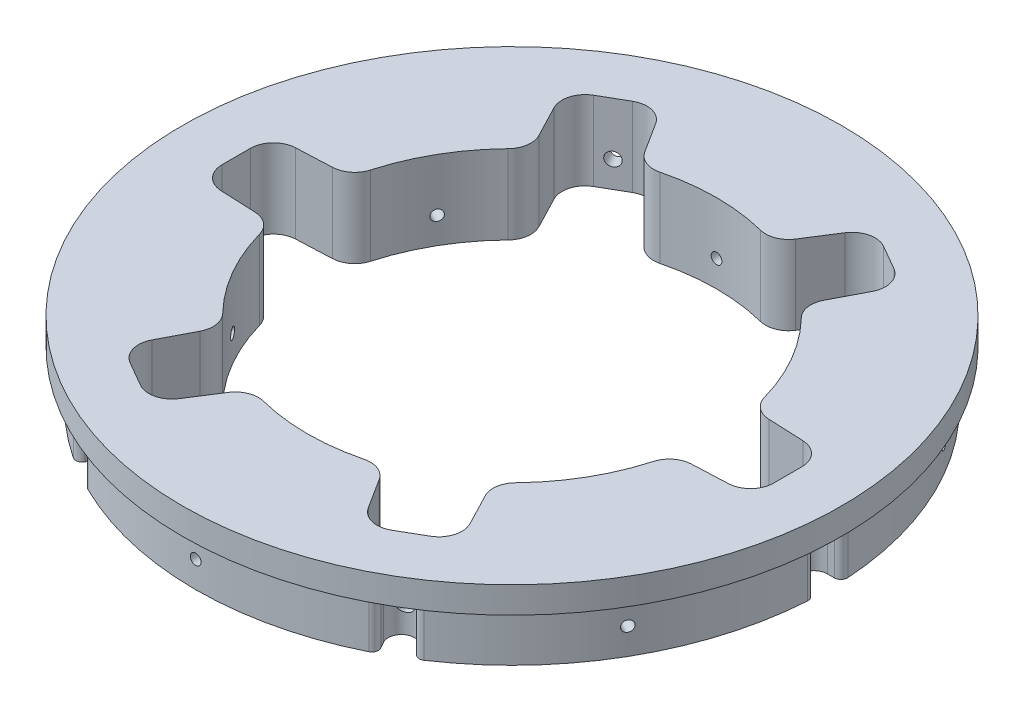
from build123d import *

# Parameters (mm, degrees)
SKETCH1_R                        = 76.2
SKETCH1_R_2                      = 49.276
BOSS_EXTRUDE1_DEPTH              = 19.05
CUT_EXTRUDE1_START               = -12.7
CUT_EXTRUDE1_DEPTH               = 12.7
CUT_EXTRUDE2_DEPTH               = 110.433918417
F_30_0_1285_DIAMETER_HOLE1_D     = 3.2639
F_30_0_1285_DIAMETER_HOLE1_DEPTH = 9.779
FILLET1_R                        = 1.5875
FILLET2_R                        = 5.55625
SKETCH11_R                       = 1.28905
CUT_EXTRUDE4_DEPTH               = 110.433918434
CIRPATTERN1_COUNT                = 6
FILLET1_OF_CIRPATTERN1_R         = 1.5875
FILLET2_OF_CIRPATTERN1_R         = 5.55625
SKETCH8_R                        = 79.375
SKETCH8_R_2                      = 76.2
BOSS_EXTRUDE3_DEPTH              = 6.35


with BuildPart() as part:
    # Sketch1 → Boss-Extrude1 (new body)
    with BuildSketch(Plane(origin=(0, 0, 0), x_dir=(1, 0, 0), z_dir=(0, 1, 0))):
        with Locations(Location((0, 0, 0), (0, 0, 270))):
            Circle(SKETCH1_R)
        with Locations(Location((0, 0, 0), (0, 0, 270))):
            Circle(SKETCH1_R_2, mode=Mode.SUBTRACT)
    extrude(amount=-BOSS_EXTRUDE1_DEPTH)

    # Sketch3 → Cut-Extrude1 (cut)
    with BuildSketch(Plane(origin=(0, -19.05, 0), x_dir=(-1, 0, 0), z_dir=(0, -1, 0)).offset(CUT_EXTRUDE1_START)):
        with BuildLine():
            Line((-76.133825433, 3.175), (-72.771, 3.175))
            ThreePointArc((-72.771, 3.175), (-69.596, 0), (-72.771, -3.175))
            Line((-72.771, -3.175), (-76.133825433, -3.175))
            ThreePointArc((-76.133825433, -3.175), (-76.2, 0), (-76.133825433, 3.175))
        make_face()
    cut_extrude1 = extrude(amount=CUT_EXTRUDE1_DEPTH, mode=Mode.SUBTRACT)

    # Sketch4 → Cut-Extrude2 (cut, through all)
    with BuildSketch(Plane(origin=(0, -19.05, 0), x_dir=(-1, 0, 0), z_dir=(0, -1, 0))):
        Polygon((-66.421, 8.73125), (-66.421, -8.73125), (-48.346649843, -9.525), (-48.346649843, 9.525), align=None)
    cut_extrude2 = extrude(amount=-CUT_EXTRUDE2_DEPTH, mode=Mode.SUBTRACT)

    # #30 (0.1285) Diameter Hole1
    with Locations(Plane.ZY.offset(-66.421)):
        with Locations((0, -12.7)):
            f_30_0_1285_diameter_hole1 = Hole(F_30_0_1285_DIAMETER_HOLE1_D / 2, depth=F_30_0_1285_DIAMETER_HOLE1_DEPTH)

    # Fillet1
    fillet1_edges = [part.edges().sort_by_distance(p)[0] for p in [
        (76.133825433, -12.7, 3.175),
        (76.133825433, -12.7, -3.175),
    ]]
    fillet(fillet1_edges, radius=FILLET1_R)

    # Fillet2
    fillet2_edges = [part.edges().sort_by_distance(p)[0] for p in [
        (66.421, -9.525, -8.73125),
        (48.346649843, -9.525, -9.525),
        (48.346649843, -9.525, 9.525),
        (66.421, -9.525, 8.73125),
    ]]
    fillet(fillet2_edges, radius=FILLET2_R)

    # Sketch11 → Cut-Extrude4 (cut, through all)
    with BuildSketch(Plane.XY):
        with Locations((0, -12.7)):
            Circle(SKETCH11_R)
    cut_extrude4 = extrude(amount=-CUT_EXTRUDE4_DEPTH, mode=Mode.SUBTRACT)

    # CirPattern1: Cut-Extrude1, Cut-Extrude2, #30 (0.1285) Diameter Hole1, Cut-Extrude4 ×6 about axis
    cirpattern1_axis = Axis((0, 0, 0), (0, 1, 0))
    add([cut_extrude1.rotate(cirpattern1_axis, i * 360 / CIRPATTERN1_COUNT) for i in range(1, CIRPATTERN1_COUNT)], mode=Mode.SUBTRACT)
    add([cut_extrude2.rotate(cirpattern1_axis, i * 360 / CIRPATTERN1_COUNT) for i in range(1, CIRPATTERN1_COUNT)], mode=Mode.SUBTRACT)
    add([f_30_0_1285_diameter_hole1.rotate(cirpattern1_axis, i * 360 / CIRPATTERN1_COUNT) for i in range(1, CIRPATTERN1_COUNT)], mode=Mode.SUBTRACT)
    add([cut_extrude4.rotate(cirpattern1_axis, i * 360 / CIRPATTERN1_COUNT) for i in range(1, CIRPATTERN1_COUNT)], mode=Mode.SUBTRACT)

    # Fillet1 of CirPattern1
    fillet1_of_cirpattern1_edges = [part.edges().sort_by_distance(p)[0] for p in [
        (40.816543373, -12.7, -64.346326912),
        (35.317282059, -12.7, -67.521326912),
        (-35.317282059, -12.7, -67.521326912),
        (-40.816543373, -12.7, -64.346326912),
        (-76.133825433, -12.7, -3.175),
        (-76.133825433, -12.7, 3.175),
        (-40.816543373, -12.7, 64.346326912),
        (-35.317282059, -12.7, 67.521326912),
        (35.317282059, -12.7, 67.521326912),
        (40.816543373, -12.7, 64.346326912),
    ]]
    fillet(fillet1_of_cirpattern1_edges, radius=FILLET1_OF_CIRPATTERN1_R)

    # Fillet2 of CirPattern1
    fillet2_of_cirpattern1_edges = [part.edges().sort_by_distance(p)[0] for p in [
        (25.649015693, -9.525, -61.887898345),
        (15.92443295, -9.525, -46.631926952),
        (32.422216892, -9.525, -37.106926952),
        (40.771984307, -9.525, -53.156648345),
        (-40.771984307, -9.525, -53.156648345),
        (-32.422216892, -9.525, -37.106926952),
        (-15.92443295, -9.525, -46.631926952),
        (-25.649015693, -9.525, -61.887898345),
        (-66.421, -9.525, 8.73125),
        (-48.346649843, -9.525, 9.525),
        (-48.346649843, -9.525, -9.525),
        (-66.421, -9.525, -8.73125),
        (-25.649015693, -9.525, 61.887898345),
        (-15.92443295, -9.525, 46.631926952),
        (-32.422216892, -9.525, 37.106926952),
        (-40.771984307, -9.525, 53.156648345),
        (40.771984307, -9.525, 53.156648345),
        (32.422216892, -9.525, 37.106926952),
        (15.92443295, -9.525, 46.631926952),
        (25.649015693, -9.525, 61.887898345),
    ]]
    fillet(fillet2_of_cirpattern1_edges, radius=FILLET2_OF_CIRPATTERN1_R)

    # Sketch8 → Boss-Extrude3 (add)
    with BuildSketch(Plane(origin=(0, 0, 0), x_dir=(1, 0, 0), z_dir=(0, 1, 0))):
        with Locations(Location((0, 0, 0), (0, 0, 270))):
            Circle(SKETCH8_R)
        Circle(SKETCH8_R_2, mode=Mode.SUBTRACT)
    extrude(amount=-BOSS_EXTRUDE3_DEPTH)


solid = part.part
